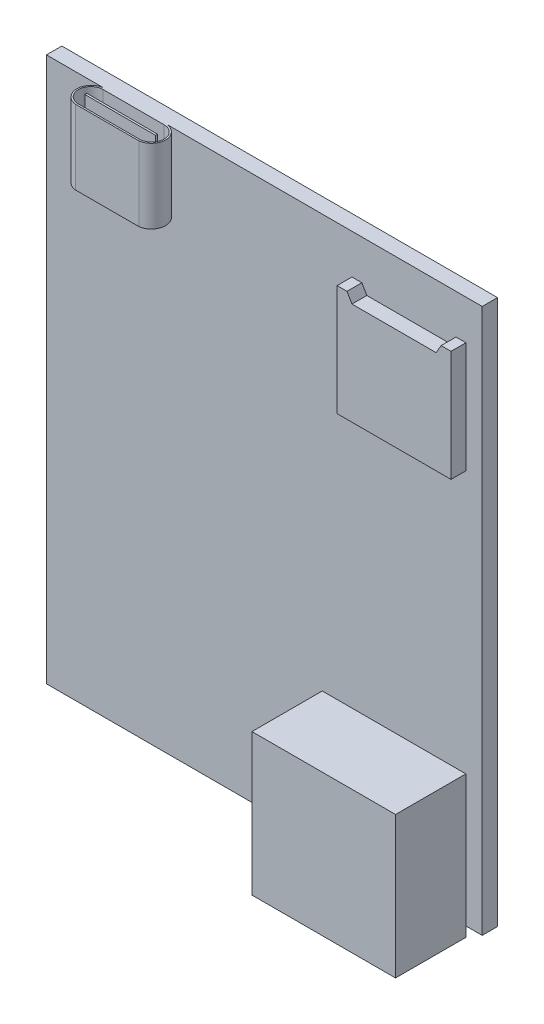
from build123d import *

# Parameters (mm, degrees)
SKETCH1_W           = 55
SKETCH1_H           = 44
BOSS_EXTRUDE1_DEPTH = 1.55
SKETCH2_W           = 14.5
SKETCH2_H           = 14.3
BOSS_EXTRUDE2_DEPTH = 7.1
SKETCH3_W           = 13.85
SKETCH3_H           = 6.5
SKETCH3_W_2         = 12.45
SKETCH3_H_2         = 1.497681088
CUT_EXTRUDE1_DEPTH  = 13.3
SKETCH4_W           = 8.95
SKETCH4_H           = 7.5
BOSS_EXTRUDE3_DEPTH = 2.85
CUT_EXTRUDE2_DEPTH  = 7.5
SKETCH5_3_W         = 7.15
SKETCH5_3_H         = 0.2
CUT_EXTRUDE3_DEPTH  = 7
BOSS_EXTRUDE4_DEPTH = 1.5


with BuildPart() as part:
    # Sketch1 → Boss-Extrude1 (new body)
    with BuildSketch(Plane(origin=(0, 0, 0), x_dir=(0, 1, 0), z_dir=(0, 0, 1))):
        Rectangle(SKETCH1_W, SKETCH1_H)
    extrude(amount=BOSS_EXTRUDE1_DEPTH)

    # Sketch2 → Boss-Extrude2 (add)
    with BuildSketch(Plane.XY.offset(1.55)):
        with Locations((13.1, -21.35)):
            Rectangle(SKETCH2_W, SKETCH2_H)
    extrude(amount=BOSS_EXTRUDE2_DEPTH)

    # Sketch3 → Cut-Extrude1 (cut)
    with BuildSketch(Plane.XZ.offset(28.5)):
        with Locations((13.1, 5.1)):
            Rectangle(SKETCH3_W, SKETCH3_H)
        with Locations((13.1, 6.101159456)):
            Rectangle(SKETCH3_W_2, SKETCH3_H_2, mode=Mode.SUBTRACT)
    extrude(amount=-CUT_EXTRUDE1_DEPTH, mode=Mode.SUBTRACT)

    # Sketch4 → Boss-Extrude3 (add)
    with BuildSketch(Plane.XY.offset(1.55)):
        with Locations((-13.025, 23.75)):
            Rectangle(SKETCH4_W, SKETCH4_H)
    extrude(amount=BOSS_EXTRUDE3_DEPTH)

    # Sketch5 → Cut-Extrude2 (cut)
    with BuildSketch(Plane(origin=(0, 27.5, 0), x_dir=(-1, 0, 0), z_dir=(0, 1, 0))):
        with BuildLine():
            Line((8.55, 4.4), (8.55, 2.975))
            ThreePointArc((8.55, 2.975), (8.910359128, 3.926260685), (9.810540583, 4.4))
            Line((9.810540583, 4.4), (8.55, 4.4))
        make_face()
        with BuildLine():
            Line((8.55, 1.55), (9.810540583, 1.55))
            ThreePointArc((9.810540583, 1.55), (8.910359128, 2.023739315), (8.55, 2.975))
            Line((8.55, 2.975), (8.55, 1.55))
        make_face()
        with BuildLine():
            Line((17.5, 1.55), (17.5, 2.975))
            ThreePointArc((17.5, 2.975), (17.139640872, 2.023739315), (16.239459417, 1.55))
            Line((16.239459417, 1.55), (17.5, 1.55))
        make_face()
        with BuildLine():
            Line((17.5, 4.4), (16.239459417, 4.4))
            ThreePointArc((16.239459417, 4.4), (17.139640872, 3.926260685), (17.5, 2.975))
            Line((17.5, 2.975), (17.5, 4.4))
        make_face()
    extrude(amount=-CUT_EXTRUDE2_DEPTH, mode=Mode.SUBTRACT)

    # Sketch5<3> → Cut-Extrude3 (cut)
    with BuildSketch(Plane(origin=(0, 27.5, 0), x_dir=(-1, 0, 0), z_dir=(0, 1, 0))):
        with BuildLine():
            Line((9.95, 1.719461162), (16.1, 1.719461162))
            ThreePointArc((16.1, 1.719461162), (17.355538838, 2.975), (16.1, 4.230538838))
            Line((16.1, 4.230538838), (9.95, 4.230538838))
            ThreePointArc((9.95, 4.230538838), (8.694461162, 2.975), (9.95, 1.719461162))
        make_face()
        with Locations((13.025, 2.975)):
            Rectangle(SKETCH5_3_W, SKETCH5_3_H, mode=Mode.SUBTRACT)
    extrude(amount=-CUT_EXTRUDE3_DEPTH, mode=Mode.SUBTRACT)

    # Sketch6 → Boss-Extrude4 (add)
    with BuildSketch(Plane.XY.offset(1.55)):
        Polygon((19.35, 23.5), (18.85, 22.633974596), (10.35, 22.633974596), (9.85, 23.5), (8.85, 23.5), (8.85, 12.3), (20.35, 12.3), (20.35, 23.5), align=None)
    extrude(amount=BOSS_EXTRUDE4_DEPTH)


solid = part.part
